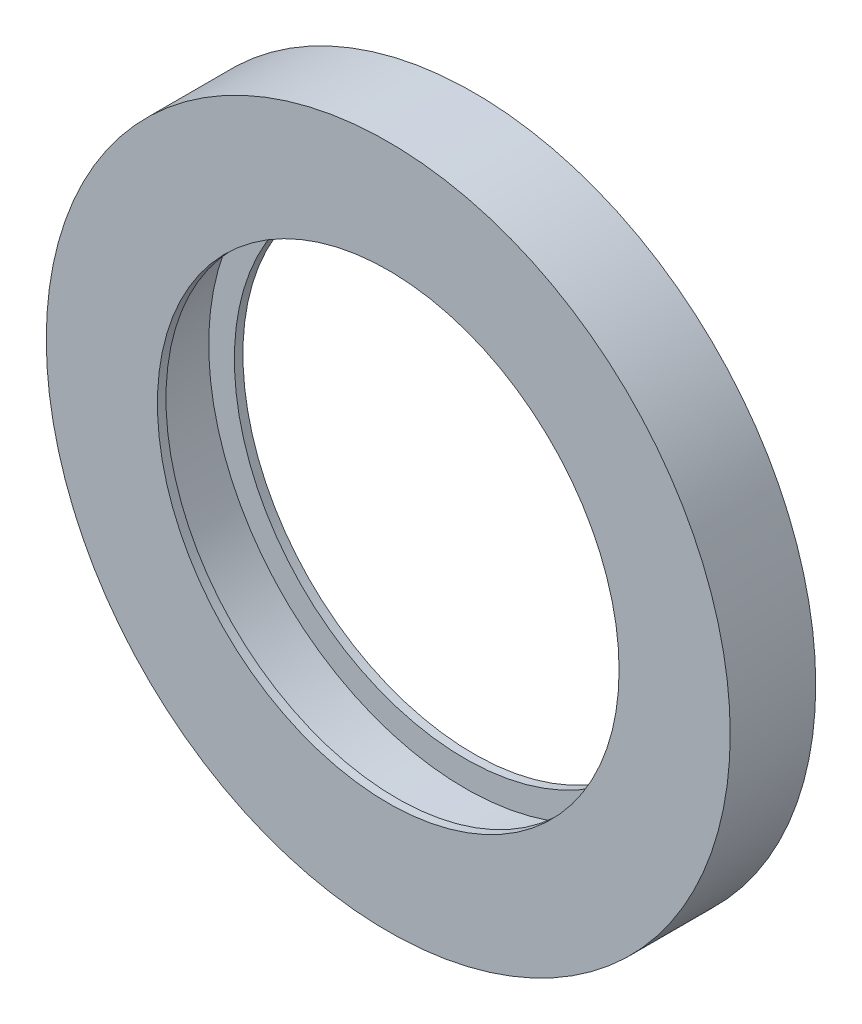
from build123d import *

# Parameters (mm, degrees)
SKETCH1_R           = 40
SKETCH1_R_2         = 30
BOSS_EXTRUDE1_DEPTH = 10
BOSS_EXTRUDE2_START = -1
SKETCH2_R           = 30
SKETCH2_R_2         = 27
BOSS_EXTRUDE2_DEPTH = 1
LPATTERN1_COUNT     = 2
LPATTERN1_PITCH     = 9


with BuildPart() as part:
    # Sketch1 → Boss-Extrude1 (new body)
    with BuildSketch(Plane.XY):
        Circle(SKETCH1_R)
        Circle(SKETCH1_R_2, mode=Mode.SUBTRACT)
    extrude(amount=BOSS_EXTRUDE1_DEPTH)

    # Sketch2 → Boss-Extrude2 (add)
    with BuildSketch(Plane.XY.offset(10).offset(BOSS_EXTRUDE2_START)):
        Circle(SKETCH2_R)
        Circle(SKETCH2_R_2, mode=Mode.SUBTRACT)
    boss_extrude2 = extrude(amount=BOSS_EXTRUDE2_DEPTH)

    # LPattern1: Boss-Extrude2 ×2
    with Locations(*[(0, 0, -i * LPATTERN1_PITCH) for i in range(1, LPATTERN1_COUNT)]):
        add(boss_extrude2)


solid = part.part
